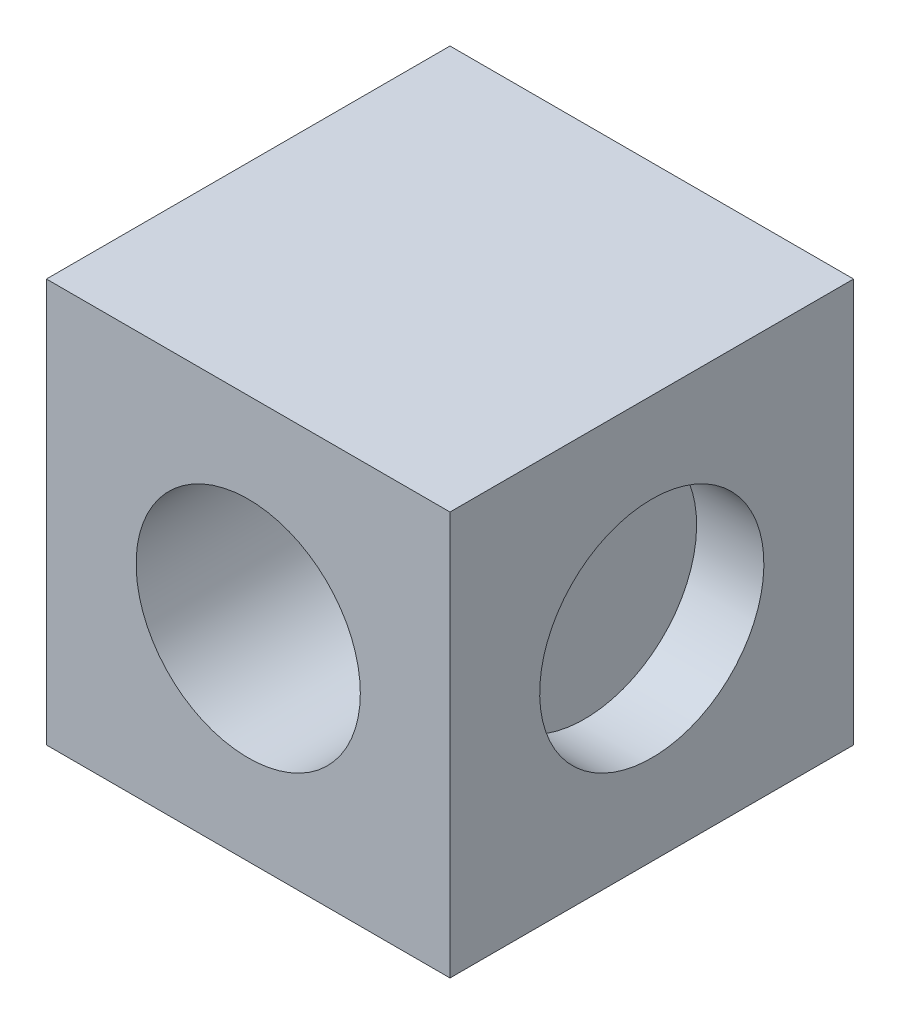
from build123d import *

# Parameters (mm, degrees)
SKETCH1_W           = 18
SKETCH1_H           = 18
SKETCH1_R           = 5
BOSS_EXTRUDE1_DEPTH = 18
SKETCH2_R           = 5
CUT_EXTRUDE1_DEPTH  = 3


with BuildPart() as part:
    # Sketch1 → Boss-Extrude1 (new body)
    with BuildSketch(Plane.XY):
        Rectangle(SKETCH1_W, SKETCH1_H)
        Circle(SKETCH1_R, mode=Mode.SUBTRACT)
    extrude(amount=BOSS_EXTRUDE1_DEPTH)

    # Sketch2 → Cut-Extrude1 (cut)
    with BuildSketch(Plane(origin=(9, 0, 0), x_dir=(0, 0, -1), z_dir=(1, 0, 0))):
        with Locations(Location((-9, 0, 0), (0, 0, 90))):
            Circle(SKETCH2_R)
    cut_extrude1 = extrude(amount=-CUT_EXTRUDE1_DEPTH, mode=Mode.SUBTRACT)

    # Mirror1: Cut-Extrude1 across plane
    add(cut_extrude1.mirror(Plane(origin=(0, 0, 0), x_dir=(0, 0, 1), z_dir=(1, 0, 0))), mode=Mode.SUBTRACT)


solid = part.part
